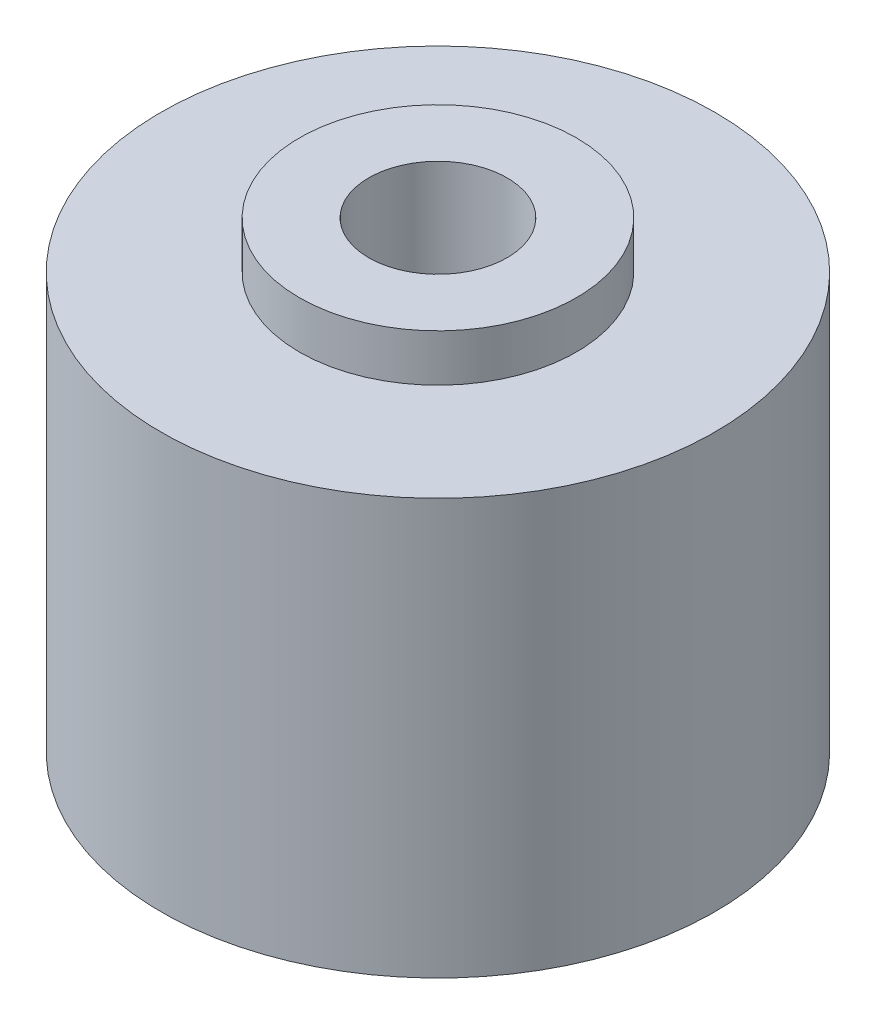
from build123d import *

# Parameters (mm, degrees)
SKETCH1_R           = 12.7
BOSS_EXTRUDE1_DEPTH = 19.05
SKETCH2_R           = 6.35
BOSS_EXTRUDE2_DEPTH = 2.159
SKETCH4_R           = 3.175
CUT_EXTRUDE4_DEPTH  = 28.792115447


with BuildPart() as part:
    # Sketch1 → Boss-Extrude1 (new body)
    with BuildSketch(Plane(origin=(0, 0, 0), x_dir=(1, 0, 0), z_dir=(0, 1, 0))):
        with Locations(Location((0, 0, 0), (0, 0, 90))):
            Circle(SKETCH1_R)
    extrude(amount=BOSS_EXTRUDE1_DEPTH)

    # Sketch2 → Boss-Extrude2 (add)
    with BuildSketch(Plane(origin=(0, 19.05, 0), x_dir=(1, 0, 0), z_dir=(0, 1, 0))):
        with Locations(Location((0, 0, 0), (0, 0, 270))):
            Circle(SKETCH2_R)
    extrude(amount=BOSS_EXTRUDE2_DEPTH)

    # Sketch4 → Cut-Extrude4 (cut, through all)
    with BuildSketch(Plane(origin=(0, 21.209, 0), x_dir=(1, 0, 0), z_dir=(0, 1, 0))):
        with Locations(Location((0, 0, 0), (0, 0, 270))):
            Circle(SKETCH4_R)
    extrude(amount=-CUT_EXTRUDE4_DEPTH, mode=Mode.SUBTRACT)


solid = part.part
